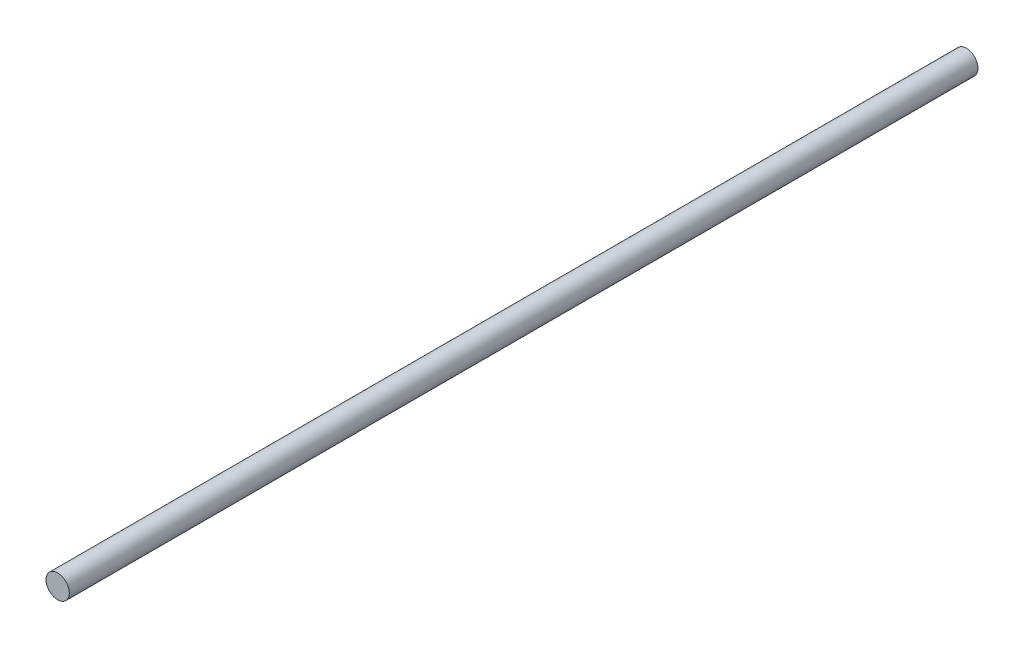
from build123d import *

# Parameters (mm, degrees)
SKETCH1_R           = 6
BOSS_EXTRUDE1_DEPTH = 468


with BuildPart() as part:
    # Sketch1 → Boss-Extrude1 (new body)
    with BuildSketch(Plane.XY):
        with Locations(Location((0, 0, 0), (0, 0, 180))):
            Circle(SKETCH1_R)
    extrude(amount=BOSS_EXTRUDE1_DEPTH)


solid = part.part
